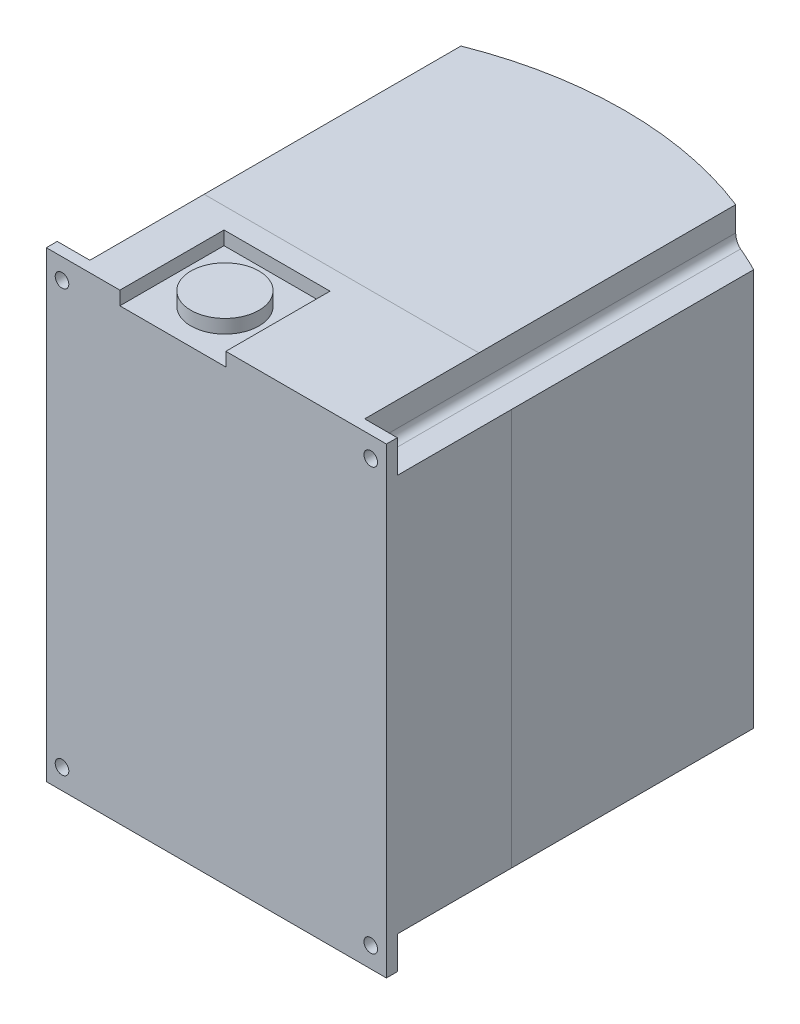
from build123d import *

# Parameters (mm, degrees)
SKETCH1_W               = 150
SKETCH1_H               = 170
BOSS_EXTRUDE1_DEPTH     = 62.5
CUT_EXTRUDE1_DEPTH      = 197.038899201
CUT_EXTRUDE1_DEPTH_BACK = 197.038899201
CUT_EXTRUDE2_START      = -4
CUT_EXTRUDE2_DEPTH      = 180.388249351
SKETCH4_R               = 2.5
CUT_EXTRUDE3_DEPTH      = 181.131202346
SKETCH7_W               = 38.956320025
SKETCH7_H               = 38.29066934
SKETCH7_R               = 12.51992823
CUT_EXTRUDE4_DEPTH      = 5


with BuildPart() as part:
    # Sketch1 → Boss-Extrude1 (new, symmetric)
    with BuildSketch(Plane(origin=(0, 0, 0), x_dir=(0, 0, -1), z_dir=(1, 0, 0))):
        Rectangle(SKETCH1_W, SKETCH1_H)
    extrude(amount=BOSS_EXTRUDE1_DEPTH, both=True)

    # Sketch2 → Cut-Extrude1 (cut, two sides: drawn at the far end of the back side and taken through both)
    with BuildSketch(Plane(origin=(0, 85, 0), x_dir=(1, 0, 0), z_dir=(0, 1, 0)).offset(-CUT_EXTRUDE1_DEPTH_BACK)):
        with BuildLine():
            Line((-399.296963127, -111.543444717), (-62.5, 60))
            ThreePointArc((-62.5, 60), (0, 75), (62.5, 60))
            Line((62.5, 60), (399.296963127, -111.543444717))
            Line((399.296963127, -111.543444717), (399.296963127, 644.391335002))
            Line((399.296963127, 644.391335002), (-399.296963127, 644.391335002))
            Line((-399.296963127, 644.391335002), (-399.296963127, -111.543444717))
        make_face()
    extrude(amount=CUT_EXTRUDE1_DEPTH + CUT_EXTRUDE1_DEPTH_BACK, mode=Mode.SUBTRACT)

    # Sketch3 → Cut-Extrude2 (cut, through all)
    with BuildSketch(Plane.XY.offset(75).offset(CUT_EXTRUDE2_START)):
        with BuildLine():
            Line((50.5, 125.138194242), (106.621589134, 125.138194242))
            Line((106.621589134, 125.138194242), (106.621589134, 73))
            Line((106.621589134, 73), (53.5, 73))
            ThreePointArc((53.5, 73), (51.378679656, 73.878679656), (50.5, 76))
            Line((50.5, 76), (50.5, 125.138194242))
        make_face()
        with BuildLine():
            Line((-106.621589134, 125.138194242), (-106.621589134, 73))
            Line((-106.621589134, 73), (-53.5, 73))
            ThreePointArc((-53.5, 73), (-51.378679656, 73.878679656), (-50.5, 76))
            Line((-50.5, 76), (-50.5, 125.138194242))
            Line((-50.5, 125.138194242), (-106.621589134, 125.138194242))
        make_face()
        with BuildLine():
            Line((-50.5, -125.138194242), (-106.621589134, -125.138194242))
            Line((-106.621589134, -125.138194242), (-106.621589134, -73))
            Line((-106.621589134, -73), (-53.5, -73))
            ThreePointArc((-53.5, -73), (-51.378679656, -73.878679656), (-50.5, -76))
            Line((-50.5, -76), (-50.5, -125.138194242))
        make_face()
        with BuildLine():
            Line((106.621589134, -125.138194242), (106.621589134, -73))
            Line((106.621589134, -73), (53.5, -73))
            ThreePointArc((53.5, -73), (51.378679656, -73.878679656), (50.5, -76))
            Line((50.5, -76), (50.5, -125.138194242))
            Line((50.5, -125.138194242), (106.621589134, -125.138194242))
        make_face()
    extrude(amount=-CUT_EXTRUDE2_DEPTH, mode=Mode.SUBTRACT)

    # Sketch4 → Cut-Extrude3 (cut, through all)
    with BuildSketch(Plane(origin=(0, 0, 71), x_dir=(-1, 0, 0), z_dir=(0, 0, -1))):
        with Locations((-56.75, 77.5)):
            Circle(SKETCH4_R)
        with Locations(Location((56.75, 77.5, 0), (0, 0, 180))):
            Circle(SKETCH4_R)
        with Locations((56.75, -77.5)):
            Circle(SKETCH4_R)
        with Locations(Location((-56.75, -77.5, 0), (0, 0, 180))):
            Circle(SKETCH4_R)
    extrude(amount=-CUT_EXTRUDE3_DEPTH, mode=Mode.SUBTRACT)

    # Sketch7 → Cut-Extrude4 (cut)
    with BuildSketch(Plane(origin=(0, 85, 0), x_dir=(1, 0, 0), z_dir=(0, 1, 0))):
        with Locations((-15.997309365, -55.85466533)):
            Rectangle(SKETCH7_W, SKETCH7_H)
        with Locations(Location((-15.997309365, -55.85466533, 0), (0, 0, 270))):
            Circle(SKETCH7_R, mode=Mode.SUBTRACT)
    extrude(amount=-CUT_EXTRUDE4_DEPTH, mode=Mode.SUBTRACT)


solid = part.part
